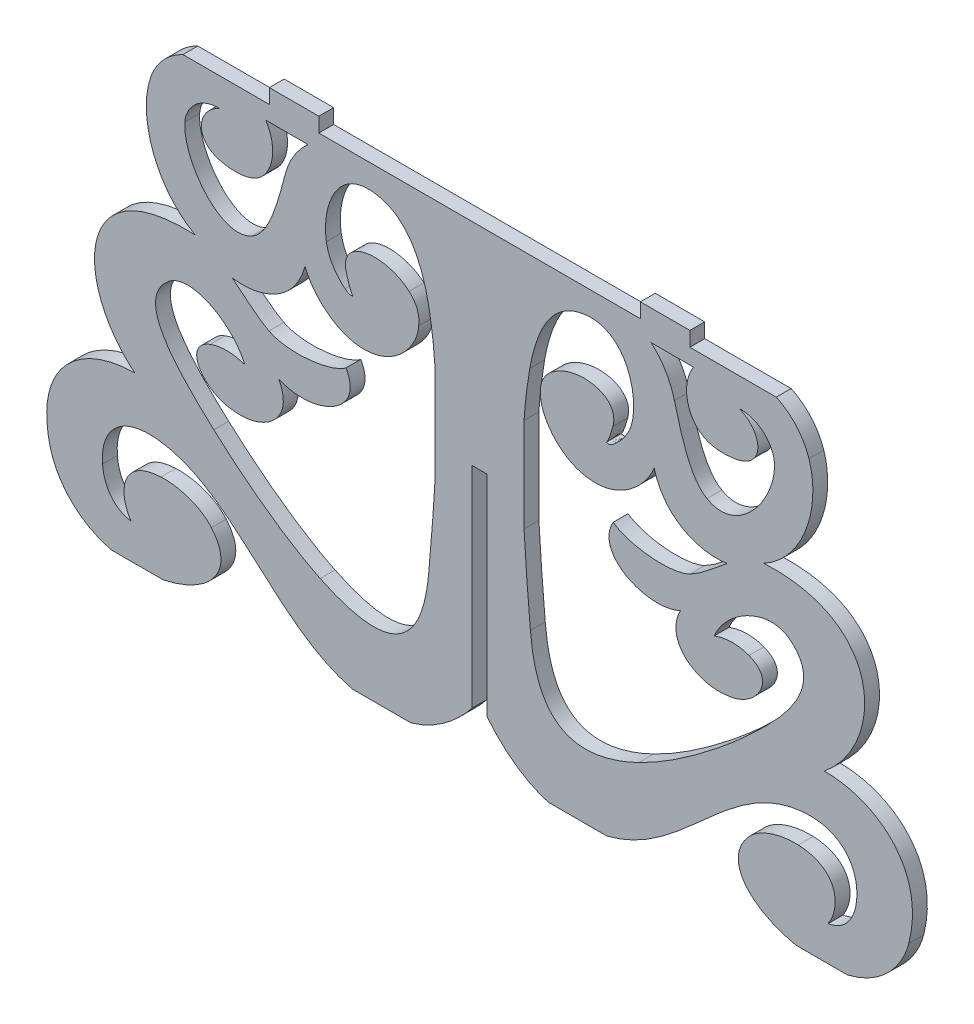
from build123d import *

# Parameters (mm, degrees)
RESSALTO_EXTRUS_O1_DEPTH = 2


with BuildPart() as part:
    # Model → Ressalto-extrusão1 (new body)
    with BuildSketch(Plane.XY):
        with BuildLine():
            Line((-25.299, -80.6801), (18.0344, -80.6801))
            Line((18.0344, -80.6801), (18.0344, -78.7123))
            Line((18.0344, -78.7123), (24.701, -78.7123))
            Line((24.701, -78.7123), (24.701, -80.6801))
            Line((24.701, -80.6801), (36.3446, -80.6801))
            add(Edge.make_bspline(
                [(40.748, -85.6548), (40.1089, -83.6954), (38.6749, -81.7888), (36.3446, -80.6801)],
                knots=[0.268292683, 0.268292683, 0.268292683, 0.268292683, 0.292682927, 0.292682927, 0.292682927, 0.292682927], degree=3))
            add(Edge.make_bspline(
                [(34.6597, -100.9082), (39.9859, -98.0452), (42.4387, -90.8382), (40.748, -85.6548)],
                knots=[0.243902439, 0.243902439, 0.243902439, 0.243902439, 0.268292683, 0.268292683, 0.268292683, 0.268292683], degree=3))
            add(Edge.make_bspline(
                [(42.8047, -121.0878), (51.071, -114.4578), (51.1176, -100.1132), (34.6597, -100.9082)],
                knots=[0.219512195, 0.219512195, 0.219512195, 0.219512195, 0.243902439, 0.243902439, 0.243902439, 0.243902439], degree=3))
            add(Edge.make_bspline(
                [(54.1991, -135.5231), (56.5947, -126.2354), (50.0219, -121.0373), (42.8047, -121.0878)],
                knots=[0.195121951, 0.195121951, 0.195121951, 0.195121951, 0.219512195, 0.219512195, 0.219512195, 0.219512195], degree=3))
            add(Edge.make_bspline(
                [(45.9466, -143.3136), (50.593, -142.1908), (53.3599, -138.7763), (54.1991, -135.5231)],
                knots=[0.170731707, 0.170731707, 0.170731707, 0.170731707, 0.195121951, 0.195121951, 0.195121951, 0.195121951], degree=3))
            Line((45.9466, -143.3136), (39.01, -143.3136))
            add(Edge.make_bspline(
                [(32.5083, -133.9746), (29.0675, -138.0023), (32.9753, -142.0567), (39.01, -143.3136)],
                knots=[0.12195122, 0.12195122, 0.12195122, 0.12195122, 0.146341463, 0.146341463, 0.146341463, 0.146341463], degree=3))
            add(Edge.make_bspline(
                [(39.3053, -131.4591), (36.7984, -131.342), (33.9868, -132.244), (32.5083, -133.9746)],
                knots=[0.097560976, 0.097560976, 0.097560976, 0.097560976, 0.12195122, 0.12195122, 0.12195122, 0.12195122], degree=3))
            add(Edge.make_bspline(
                [(43.3255, -138.6275), (45.091, -136.0452), (44.7729, -131.7145), (39.3053, -131.4591)],
                knots=[0.073170732, 0.073170732, 0.073170732, 0.073170732, 0.097560976, 0.097560976, 0.097560976, 0.097560976], degree=3))
            add(Edge.make_bspline(
                [(47.1792, -133.8877), (46.9993, -136.07), (45.898, -138.1875), (43.3255, -138.6275)],
                knots=[0.048780488, 0.048780488, 0.048780488, 0.048780488, 0.073170732, 0.073170732, 0.073170732, 0.073170732], degree=3))
            add(Edge.make_bspline(
                [(39.7847, -127.3008), (44.8462, -126.7846), (47.5126, -129.843), (47.1792, -133.8877)],
                knots=[0.024390244, 0.024390244, 0.024390244, 0.024390244, 0.048780488, 0.048780488, 0.048780488, 0.048780488], degree=3))
            add(Edge.make_bspline(
                [(13.5276, -143.3136), (24.0999, -140.6337), (29.5908, -128.3406), (39.7847, -127.3008)],
                knots=[0, 0, 0, 0, 0.024390244, 0.024390244, 0.024390244, 0.024390244], degree=3))
            Line((13.5276, -143.3136), (5.6181, -143.3136))
            add(Edge.make_bspline(
                [(-2.6323, -137.4568), (-1.212, -139.244), (1.6013, -142.1463), (5.6181, -143.3136)],
                knots=[0.926829268, 0.926829268, 0.926829268, 0.926829268, 0.951219512, 0.951219512, 0.951219512, 0.951219512], degree=3))
            Line((-2.6323, -137.4568), (-2.6323, -109.1511))
            Line((-2.6323, -109.1511), (-4.6323, -109.1511))
            Line((-4.6323, -109.1511), (-4.6323, -137.4568))
            add(Edge.make_bspline(
                [(-12.8827, -143.3136), (-8.8659, -142.1463), (-6.0526, -139.244), (-4.6323, -137.4568)],
                knots=[0.829268293, 0.829268293, 0.829268293, 0.829268293, 0.853658537, 0.853658537, 0.853658537, 0.853658537], degree=3))
            Line((-12.8827, -143.3136), (-20.7922, -143.3136))
            add(Edge.make_bspline(
                [(-47.0493, -127.3008), (-36.8554, -128.3406), (-31.3645, -140.6337), (-20.7922, -143.3136)],
                knots=[0.780487805, 0.780487805, 0.780487805, 0.780487805, 0.804878049, 0.804878049, 0.804878049, 0.804878049], degree=3))
            add(Edge.make_bspline(
                [(-54.4438, -133.8877), (-54.7772, -129.843), (-52.1108, -126.7846), (-47.0493, -127.3008)],
                knots=[0.756097561, 0.756097561, 0.756097561, 0.756097561, 0.780487805, 0.780487805, 0.780487805, 0.780487805], degree=3))
            add(Edge.make_bspline(
                [(-50.5901, -138.6275), (-53.1626, -138.1875), (-54.2639, -136.07), (-54.4438, -133.8877)],
                knots=[0.731707317, 0.731707317, 0.731707317, 0.731707317, 0.756097561, 0.756097561, 0.756097561, 0.756097561], degree=3))
            add(Edge.make_bspline(
                [(-46.5699, -131.4591), (-52.0375, -131.7145), (-52.3556, -136.0452), (-50.5901, -138.6275)],
                knots=[0.707317073, 0.707317073, 0.707317073, 0.707317073, 0.731707317, 0.731707317, 0.731707317, 0.731707317], degree=3))
            add(Edge.make_bspline(
                [(-39.7729, -133.9746), (-41.2514, -132.244), (-44.063, -131.342), (-46.5699, -131.4591)],
                knots=[0.682926829, 0.682926829, 0.682926829, 0.682926829, 0.707317073, 0.707317073, 0.707317073, 0.707317073], degree=3))
            add(Edge.make_bspline(
                [(-46.2746, -143.3136), (-40.2399, -142.0567), (-36.3321, -138.0023), (-39.7729, -133.9746)],
                knots=[0.658536585, 0.658536585, 0.658536585, 0.658536585, 0.682926829, 0.682926829, 0.682926829, 0.682926829], degree=3))
            Line((-46.2746, -143.3136), (-53.2112, -143.3136))
            add(Edge.make_bspline(
                [(-61.4637, -135.5231), (-60.6245, -138.7763), (-57.8576, -142.1908), (-53.2112, -143.3136)],
                knots=[0.609756098, 0.609756098, 0.609756098, 0.609756098, 0.634146341, 0.634146341, 0.634146341, 0.634146341], degree=3))
            add(Edge.make_bspline(
                [(-50.0693, -121.0878), (-57.2865, -121.0373), (-63.8593, -126.2354), (-61.4637, -135.5231)],
                knots=[0.585365854, 0.585365854, 0.585365854, 0.585365854, 0.609756098, 0.609756098, 0.609756098, 0.609756098], degree=3))
            add(Edge.make_bspline(
                [(-41.9243, -100.9082), (-58.3822, -100.1132), (-58.3356, -114.4578), (-50.0693, -121.0878)],
                knots=[0.56097561, 0.56097561, 0.56097561, 0.56097561, 0.585365854, 0.585365854, 0.585365854, 0.585365854], degree=3))
            add(Edge.make_bspline(
                [(-48.0126, -85.6548), (-49.7033, -90.8382), (-47.2505, -98.0452), (-41.9243, -100.9082)],
                knots=[0.536585366, 0.536585366, 0.536585366, 0.536585366, 0.56097561, 0.56097561, 0.56097561, 0.56097561], degree=3))
            add(Edge.make_bspline(
                [(-43.6092, -80.6801), (-45.9395, -81.7888), (-47.3735, -83.6954), (-48.0126, -85.6548)],
                knots=[0.512195122, 0.512195122, 0.512195122, 0.512195122, 0.536585366, 0.536585366, 0.536585366, 0.536585366], degree=3))
            Line((-43.6092, -80.6801), (-31.9656, -80.6801))
            Line((-31.9656, -80.6801), (-31.9656, -78.7123))
            Line((-31.9656, -78.7123), (-25.299, -78.7123))
            Line((-25.299, -78.7123), (-25.299, -80.6801))
        make_face()
        with BuildLine():
            Line((-26.7511, -82.7498), (-32.4569, -82.7498))
            add(Edge.make_bspline(
                [(-32.4569, -82.7498), (-31.1733, -84.7323), (-31.2313, -87.2662), (-32.4844, -89.0266)],
                knots=[0, 0, 0, 0, 0.111111111, 0.111111111, 0.111111111, 0.111111111], degree=3))
            add(Edge.make_bspline(
                [(-32.4844, -89.0266), (-33.3768, -90.2802), (-35.0403, -91.1102), (-37.9276, -90.6875)],
                knots=[0.111111111, 0.111111111, 0.111111111, 0.111111111, 0.222222222, 0.222222222, 0.222222222, 0.222222222], degree=3))
            add(Edge.make_bspline(
                [(-37.9276, -90.6875), (-42.1519, -90.0692), (-41.9903, -85.9673), (-38.6474, -84.4976)],
                knots=[0.222222222, 0.222222222, 0.222222222, 0.222222222, 0.333333333, 0.333333333, 0.333333333, 0.333333333], degree=3))
            add(Edge.make_bspline(
                [(-38.6474, -84.4976), (-41.6734, -84.4609), (-43.2427, -86.7759), (-43.3562, -88.4235)],
                knots=[0.333333333, 0.333333333, 0.333333333, 0.333333333, 0.444444444, 0.444444444, 0.444444444, 0.444444444], degree=3))
            add(Edge.make_bspline(
                [(-43.3562, -88.4235), (-43.6636, -92.8804), (-38.5123, -99.6442), (-34.2704, -97.1791)],
                knots=[0.444444444, 0.444444444, 0.444444444, 0.444444444, 0.555555556, 0.555555556, 0.555555556, 0.555555556], degree=3))
            add(Edge.make_bspline(
                [(-34.2704, -97.1791), (-32.5007, -96.1507), (-31.3381, -93.6932), (-29.8837, -87.9524)],
                knots=[0.555555556, 0.555555556, 0.555555556, 0.555555556, 0.666666667, 0.666666667, 0.666666667, 0.666666667], degree=3))
            add(Edge.make_bspline(
                [(-29.8837, -87.9524), (-29.3667, -85.9116), (-28.3138, -84.1273), (-26.7511, -82.7498)],
                knots=[0.666666667, 0.666666667, 0.666666667, 0.666666667, 0.777777778, 0.777777778, 0.777777778, 0.777777778], degree=3))
        make_face(mode=Mode.SUBTRACT)
        with BuildLine():
            Line((-9.6217, -113.0468), (-9.6217, -100.393))
            add(Edge.make_bspline(
                [(-9.6217, -100.393), (-9.7726, -98.2023), (-10.0208, -96.045), (-10.3939, -93.9386)],
                knots=[0.041666667, 0.041666667, 0.041666667, 0.041666667, 0.083333333, 0.083333333, 0.083333333, 0.083333333], degree=3))
            add(Edge.make_bspline(
                [(-10.3939, -93.9386), (-11.331, -88.6476), (-13.5268, -84.1713), (-18.2928, -83.8913)],
                knots=[0.083333333, 0.083333333, 0.083333333, 0.083333333, 0.125, 0.125, 0.125, 0.125], degree=3))
            add(Edge.make_bspline(
                [(-18.2928, -83.8913), (-23.0171, -83.6137), (-24.9083, -88.9647), (-24.2808, -92.8525)],
                knots=[0.125, 0.125, 0.125, 0.125, 0.166666667, 0.166666667, 0.166666667, 0.166666667], degree=3))
            add(Edge.make_bspline(
                [(-24.2808, -92.8525), (-24.0259, -94.4318), (-23.2335, -95.8334), (-21.7588, -97.078)],
                knots=[0.166666667, 0.166666667, 0.166666667, 0.166666667, 0.208333333, 0.208333333, 0.208333333, 0.208333333], degree=3))
            add(Edge.make_bspline(
                [(-21.7588, -97.078), (-21.3405, -97.4311), (-20.9898, -97.5247), (-20.7021, -97.3929)],
                knots=[0.208333333, 0.208333333, 0.208333333, 0.208333333, 0.25, 0.25, 0.25, 0.25], degree=3))
            add(Edge.make_bspline(
                [(-20.7021, -97.3929), (-20.8973, -97.2341), (-21.1963, -96.5924), (-21.5905, -95.1207)],
                knots=[0.25, 0.25, 0.25, 0.25, 0.291666667, 0.291666667, 0.291666667, 0.291666667], degree=3))
            add(Edge.make_bspline(
                [(-21.5905, -95.1207), (-22.6756, -91.07), (-16.2984, -90.2558), (-13.1252, -93.083)],
                knots=[0.291666667, 0.291666667, 0.291666667, 0.291666667, 0.333333333, 0.333333333, 0.333333333, 0.333333333], degree=3))
            add(Edge.make_bspline(
                [(-13.1252, -93.083), (-12.1537, -93.9486), (-11.6464, -95.1051), (-11.8511, -96.4742)],
                knots=[0.333333333, 0.333333333, 0.333333333, 0.333333333, 0.375, 0.375, 0.375, 0.375], degree=3))
            add(Edge.make_bspline(
                [(-11.8511, -96.4742), (-11.9194, -98.9913), (-15.0834, -103.3668), (-20.0254, -102.8281)],
                knots=[0.375, 0.375, 0.375, 0.375, 0.416666667, 0.416666667, 0.416666667, 0.416666667], degree=3))
            add(Edge.make_bspline(
                [(-20.0254, -102.8281), (-23.5148, -102.4476), (-26.3139, -99.4595), (-27.1557, -97.1641)],
                knots=[0.416666667, 0.416666667, 0.416666667, 0.416666667, 0.458333333, 0.458333333, 0.458333333, 0.458333333], degree=3))
            add(Edge.make_bspline(
                [(-27.1557, -97.1641), (-28.5683, -102.4552), (-33.5101, -103.9638), (-36.9867, -103.4069)],
                knots=[0.458333333, 0.458333333, 0.458333333, 0.458333333, 0.5, 0.5, 0.5, 0.5], degree=3))
            add(Edge.make_bspline(
                [(-36.9867, -103.4069), (-35.3064, -104.7163), (-33.7715, -106.2083), (-32.007, -107.1244)],
                knots=[0.5, 0.5, 0.5, 0.5, 0.541666667, 0.541666667, 0.541666667, 0.541666667], degree=3))
            add(Edge.make_bspline(
                [(-32.007, -107.1244), (-29.3781, -108.4896), (-23.7227, -107.8286), (-21.6381, -106.2645)],
                knots=[0.541666667, 0.541666667, 0.541666667, 0.541666667, 0.583333333, 0.583333333, 0.583333333, 0.583333333], degree=3))
            add(Edge.make_bspline(
                [(-21.6381, -106.2645), (-18.9894, -110.8906), (-26.1931, -114.1757), (-30.699, -112.0561)],
                knots=[0.583333333, 0.583333333, 0.583333333, 0.583333333, 0.625, 0.625, 0.625, 0.625], degree=3))
            add(Edge.make_bspline(
                [(-30.699, -112.0561), (-28.4119, -116.3864), (-32.9424, -119.4988), (-37.1074, -118.7844)],
                knots=[0.625, 0.625, 0.625, 0.625, 0.666666667, 0.666666667, 0.666666667, 0.666666667], degree=3))
            add(Edge.make_bspline(
                [(-37.1074, -118.7844), (-40.7542, -118.4687), (-43.8613, -114.1754), (-39.9339, -112.6598)],
                knots=[0.666666667, 0.666666667, 0.666666667, 0.666666667, 0.708333333, 0.708333333, 0.708333333, 0.708333333], degree=3))
            add(Edge.make_bspline(
                [(-39.9339, -112.6598), (-38.6761, -112.1744), (-36.9586, -112.0849), (-35.2485, -112.716)],
                knots=[0.708333333, 0.708333333, 0.708333333, 0.708333333, 0.75, 0.75, 0.75, 0.75], degree=3))
            add(Edge.make_bspline(
                [(-35.2485, -112.716), (-36.9784, -108.7073), (-42.6099, -105.7375), (-45.5096, -108.0977)],
                knots=[0.75, 0.75, 0.75, 0.75, 0.791666667, 0.791666667, 0.791666667, 0.791666667], degree=3))
            add(Edge.make_bspline(
                [(-45.5096, -108.0977), (-50.1258, -111.855), (-44.9673, -117.3572), (-39.4446, -122.3875)],
                knots=[0.791666667, 0.791666667, 0.791666667, 0.791666667, 0.833333333, 0.833333333, 0.833333333, 0.833333333], degree=3))
            add(Edge.make_bspline(
                [(-39.4446, -122.3875), (-36.6658, -124.9185), (-30.845, -129.788), (-25.1107, -132.5742)],
                knots=[0.833333333, 0.833333333, 0.833333333, 0.833333333, 0.875, 0.875, 0.875, 0.875], degree=3))
            add(Edge.make_bspline(
                [(-25.1107, -132.5742), (-13.1524, -138.3844), (-10.9954, -130.4623), (-10.4758, -124.4534)],
                knots=[0.875, 0.875, 0.875, 0.875, 0.916666667, 0.916666667, 0.916666667, 0.916666667], degree=3))
            add(Edge.make_bspline(
                [(-10.4758, -124.4534), (-10.1517, -120.706), (-9.8219, -116.8755), (-9.6217, -113.0468)],
                knots=[0.916666667, 0.916666667, 0.916666667, 0.916666667, 1, 1, 1, 1], degree=3))
        make_face(mode=Mode.SUBTRACT)
        with BuildLine():
            Line((19.4865, -82.7498), (25.1923, -82.7498))
            add(Edge.make_bspline(
                [(25.1923, -82.7498), (23.9087, -84.7323), (23.9667, -87.2662), (25.2198, -89.0266)],
                knots=[0, 0, 0, 0, 0.111111111, 0.111111111, 0.111111111, 0.111111111], degree=3))
            add(Edge.make_bspline(
                [(25.2198, -89.0266), (26.1122, -90.2802), (27.7757, -91.1102), (30.663, -90.6875)],
                knots=[0.111111111, 0.111111111, 0.111111111, 0.111111111, 0.222222222, 0.222222222, 0.222222222, 0.222222222], degree=3))
            add(Edge.make_bspline(
                [(30.663, -90.6875), (34.8873, -90.0692), (34.7257, -85.9673), (31.3828, -84.4976)],
                knots=[0.222222222, 0.222222222, 0.222222222, 0.222222222, 0.333333333, 0.333333333, 0.333333333, 0.333333333], degree=3))
            add(Edge.make_bspline(
                [(31.3828, -84.4976), (34.4088, -84.4609), (35.9781, -86.7759), (36.0916, -88.4235)],
                knots=[0.333333333, 0.333333333, 0.333333333, 0.333333333, 0.444444444, 0.444444444, 0.444444444, 0.444444444], degree=3))
            add(Edge.make_bspline(
                [(36.0916, -88.4235), (36.399, -92.8804), (31.2477, -99.6442), (27.0058, -97.1791)],
                knots=[0.444444444, 0.444444444, 0.444444444, 0.444444444, 0.555555556, 0.555555556, 0.555555556, 0.555555556], degree=3))
            add(Edge.make_bspline(
                [(27.0058, -97.1791), (25.2361, -96.1507), (24.0735, -93.6932), (22.6191, -87.9524)],
                knots=[0.555555556, 0.555555556, 0.555555556, 0.555555556, 0.666666667, 0.666666667, 0.666666667, 0.666666667], degree=3))
            add(Edge.make_bspline(
                [(22.6191, -87.9524), (22.1021, -85.9116), (21.0492, -84.1273), (19.4865, -82.7498)],
                knots=[0.666666667, 0.666666667, 0.666666667, 0.666666667, 0.777777778, 0.777777778, 0.777777778, 0.777777778], degree=3))
        make_face(mode=Mode.SUBTRACT)
        with BuildLine():
            Line((2.3571, -113.0468), (2.3571, -100.393))
            add(Edge.make_bspline(
                [(2.3571, -100.393), (2.508, -98.2023), (2.7562, -96.045), (3.1293, -93.9386)],
                knots=[0.041666667, 0.041666667, 0.041666667, 0.041666667, 0.083333333, 0.083333333, 0.083333333, 0.083333333], degree=3))
            add(Edge.make_bspline(
                [(3.1293, -93.9386), (4.0664, -88.6476), (6.2622, -84.1713), (11.0282, -83.8913)],
                knots=[0.083333333, 0.083333333, 0.083333333, 0.083333333, 0.125, 0.125, 0.125, 0.125], degree=3))
            add(Edge.make_bspline(
                [(11.0282, -83.8913), (15.7525, -83.6137), (17.6437, -88.9647), (17.0162, -92.8525)],
                knots=[0.125, 0.125, 0.125, 0.125, 0.166666667, 0.166666667, 0.166666667, 0.166666667], degree=3))
            add(Edge.make_bspline(
                [(17.0162, -92.8525), (16.7613, -94.4318), (15.9689, -95.8334), (14.4942, -97.078)],
                knots=[0.166666667, 0.166666667, 0.166666667, 0.166666667, 0.208333333, 0.208333333, 0.208333333, 0.208333333], degree=3))
            add(Edge.make_bspline(
                [(14.4942, -97.078), (14.0759, -97.4311), (13.7252, -97.5247), (13.4375, -97.3929)],
                knots=[0.208333333, 0.208333333, 0.208333333, 0.208333333, 0.25, 0.25, 0.25, 0.25], degree=3))
            add(Edge.make_bspline(
                [(13.4375, -97.3929), (13.6327, -97.2341), (13.9317, -96.5924), (14.3259, -95.1207)],
                knots=[0.25, 0.25, 0.25, 0.25, 0.291666667, 0.291666667, 0.291666667, 0.291666667], degree=3))
            add(Edge.make_bspline(
                [(14.3259, -95.1207), (15.411, -91.07), (9.0338, -90.2558), (5.8606, -93.083)],
                knots=[0.291666667, 0.291666667, 0.291666667, 0.291666667, 0.333333333, 0.333333333, 0.333333333, 0.333333333], degree=3))
            add(Edge.make_bspline(
                [(5.8606, -93.083), (4.8891, -93.9486), (4.3818, -95.1051), (4.5865, -96.4742)],
                knots=[0.333333333, 0.333333333, 0.333333333, 0.333333333, 0.375, 0.375, 0.375, 0.375], degree=3))
            add(Edge.make_bspline(
                [(4.5865, -96.4742), (4.6548, -98.9913), (7.8188, -103.3668), (12.7608, -102.8281)],
                knots=[0.375, 0.375, 0.375, 0.375, 0.416666667, 0.416666667, 0.416666667, 0.416666667], degree=3))
            add(Edge.make_bspline(
                [(12.7608, -102.8281), (16.2502, -102.4476), (19.0493, -99.4595), (19.8911, -97.1641)],
                knots=[0.416666667, 0.416666667, 0.416666667, 0.416666667, 0.458333333, 0.458333333, 0.458333333, 0.458333333], degree=3))
            add(Edge.make_bspline(
                [(19.8911, -97.1641), (21.3037, -102.4552), (26.2455, -103.9638), (29.7221, -103.4069)],
                knots=[0.458333333, 0.458333333, 0.458333333, 0.458333333, 0.5, 0.5, 0.5, 0.5], degree=3))
            add(Edge.make_bspline(
                [(29.7221, -103.4069), (28.0418, -104.7163), (26.5069, -106.2083), (24.7424, -107.1244)],
                knots=[0.5, 0.5, 0.5, 0.5, 0.541666667, 0.541666667, 0.541666667, 0.541666667], degree=3))
            add(Edge.make_bspline(
                [(24.7424, -107.1244), (22.1135, -108.4896), (16.4581, -107.8286), (14.3735, -106.2645)],
                knots=[0.541666667, 0.541666667, 0.541666667, 0.541666667, 0.583333333, 0.583333333, 0.583333333, 0.583333333], degree=3))
            add(Edge.make_bspline(
                [(14.3735, -106.2645), (11.7248, -110.8906), (18.9285, -114.1757), (23.4344, -112.0561)],
                knots=[0.583333333, 0.583333333, 0.583333333, 0.583333333, 0.625, 0.625, 0.625, 0.625], degree=3))
            add(Edge.make_bspline(
                [(23.4344, -112.0561), (21.1473, -116.3864), (25.6778, -119.4988), (29.8428, -118.7844)],
                knots=[0.625, 0.625, 0.625, 0.625, 0.666666667, 0.666666667, 0.666666667, 0.666666667], degree=3))
            add(Edge.make_bspline(
                [(29.8428, -118.7844), (33.4896, -118.4687), (36.5967, -114.1754), (32.6693, -112.6598)],
                knots=[0.666666667, 0.666666667, 0.666666667, 0.666666667, 0.708333333, 0.708333333, 0.708333333, 0.708333333], degree=3))
            add(Edge.make_bspline(
                [(32.6693, -112.6598), (31.4115, -112.1744), (29.694, -112.0849), (27.9839, -112.716)],
                knots=[0.708333333, 0.708333333, 0.708333333, 0.708333333, 0.75, 0.75, 0.75, 0.75], degree=3))
            add(Edge.make_bspline(
                [(27.9839, -112.716), (29.7138, -108.7073), (35.3453, -105.7375), (38.245, -108.0977)],
                knots=[0.75, 0.75, 0.75, 0.75, 0.791666667, 0.791666667, 0.791666667, 0.791666667], degree=3))
            add(Edge.make_bspline(
                [(38.245, -108.0977), (42.8612, -111.855), (37.7027, -117.3572), (32.18, -122.3875)],
                knots=[0.791666667, 0.791666667, 0.791666667, 0.791666667, 0.833333333, 0.833333333, 0.833333333, 0.833333333], degree=3))
            add(Edge.make_bspline(
                [(32.18, -122.3875), (29.4012, -124.9185), (23.5804, -129.788), (17.8461, -132.5742)],
                knots=[0.833333333, 0.833333333, 0.833333333, 0.833333333, 0.875, 0.875, 0.875, 0.875], degree=3))
            add(Edge.make_bspline(
                [(17.8461, -132.5742), (5.8878, -138.3844), (3.7308, -130.4623), (3.2112, -124.4534)],
                knots=[0.875, 0.875, 0.875, 0.875, 0.916666667, 0.916666667, 0.916666667, 0.916666667], degree=3))
            add(Edge.make_bspline(
                [(3.2112, -124.4534), (2.8871, -120.706), (2.5573, -116.8755), (2.3571, -113.0468)],
                knots=[0.916666667, 0.916666667, 0.916666667, 0.916666667, 1, 1, 1, 1], degree=3))
        make_face(mode=Mode.SUBTRACT)
    extrude(amount=RESSALTO_EXTRUS_O1_DEPTH)


solid = part.part
